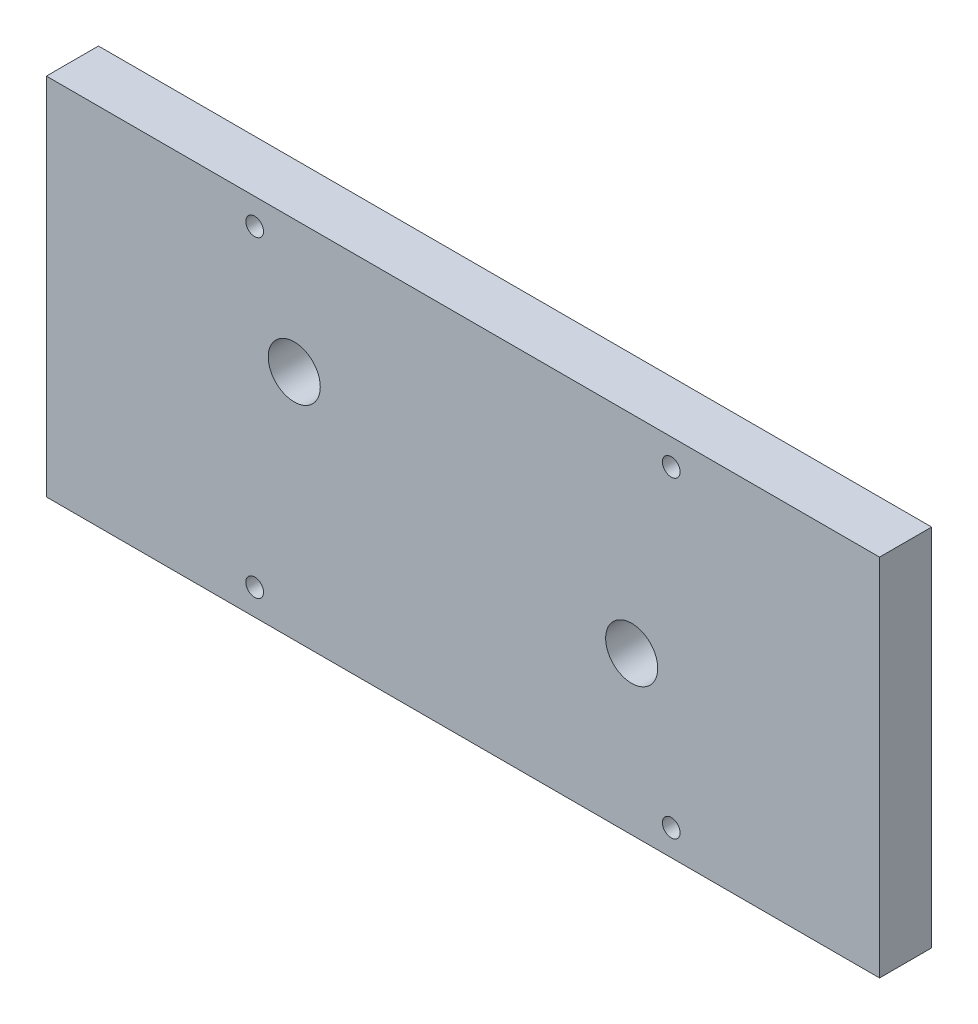
from build123d import *

# Parameters (mm, degrees)
ESBO_O1_W                = 160
ESBO_O1_H                = 70
RESSALTO_EXTRUS_O1_DEPTH = 10
FURO_COM_FOLGA_DE_M33_D  = 3.4
ESBO_O6_R                = 5
CORTE_EXTRUS_O1_DEPTH    = 10
FURO_COM_FOLGA_DE_M61_D  = 6.6


with BuildPart() as part:
    # Esboço1 → Ressalto-extrusão1 (new body)
    with BuildSketch(Plane(origin=(0, 0, 92.2731107), x_dir=(-1, 0, 0), z_dir=(0, 0, -1))):
        with Locations((66.819307324, 485.108658775)):
            Rectangle(ESBO_O1_W, ESBO_O1_H)
    extrude(amount=RESSALTO_EXTRUS_O1_DEPTH)

    # Furo com folga de M33 (through all)
    with Locations(Plane.XY.offset(92.2731107)):
        with Locations((-106.819307324, 515.108658775), (-26.819307324, 515.108658775), (-26.819307324, 455.108658775), (-106.819307324, 455.108658775)):
            Hole(FURO_COM_FOLGA_DE_M33_D / 2)

    # Esboço6 → Corte-extrusão1 (cut)
    with BuildSketch(Plane.XY.offset(93.7731107)):
        with Locations((-34.419307324, 480.308658775)):
            Circle(ESBO_O6_R)
        with Locations((-99.219307324, 494.708658775)):
            Circle(ESBO_O6_R)
    extrude(amount=-CORTE_EXTRUS_O1_DEPTH, mode=Mode.SUBTRACT)

    # Furo com folga de M61 (through all)
    with Locations(Plane.XY.offset(83.7731107)):
        with Locations((-99.219307324, 494.708658775), (-34.419307324, 480.308658775)):
            Hole(FURO_COM_FOLGA_DE_M61_D / 2)


solid = part.part
